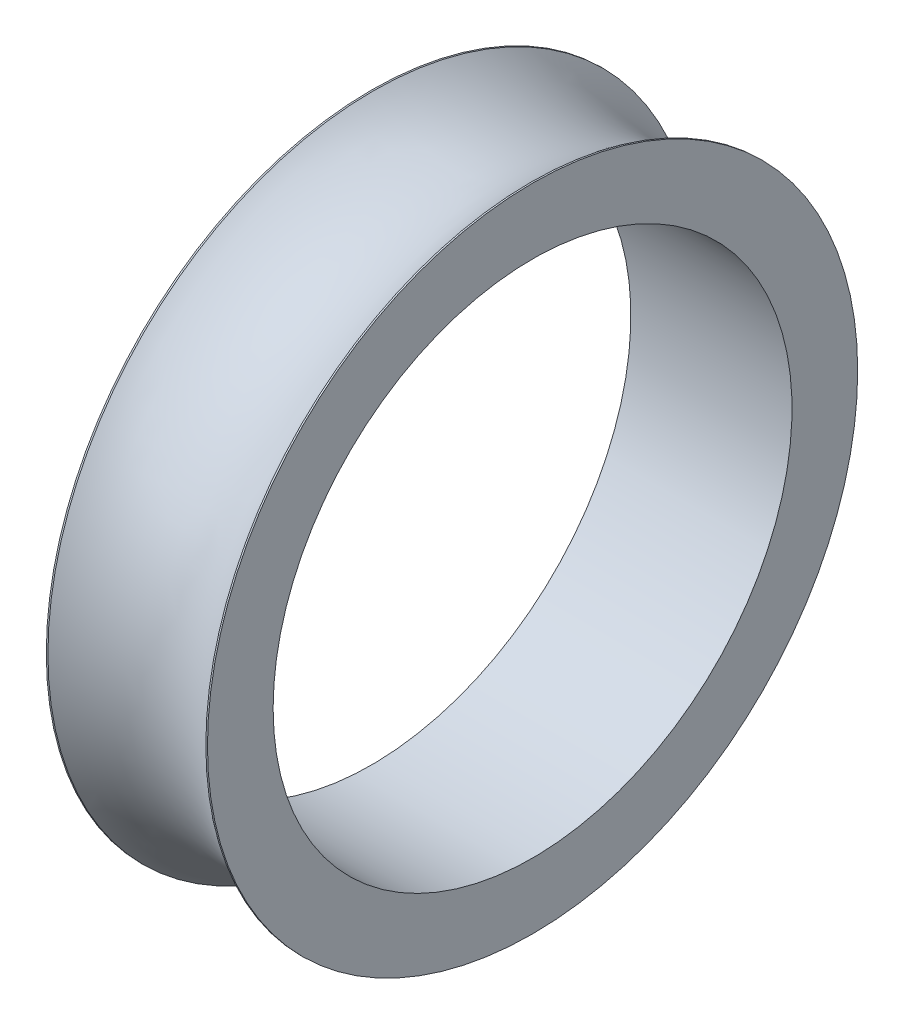
from build123d import *


with BuildPart() as part:
    # Sketch1 → Revolve1 (revolve)
    with BuildSketch(Plane.XY, mode=Mode.PRIVATE) as revolve1_sk:
        with BuildLine():
            Line((-2.45, -3.161882351), (-2.5, -3.161882351))
            Line((-2.5, -3.161882351), (-2.5, -5.2))
            Line((-2.5, -5.2), (2.5, -5.2))
            Line((2.5, -5.2), (2.5, -3.161882351))
            Line((2.5, -3.161882351), (2.45, -3.161882351))
            ThreePointArc((2.45, -3.161882351), (0, -4), (-2.45, -3.161882351))
        make_face()
    revolve(revolve1_sk.sketch.rotate(Axis((-2.5, -13.25, 0), (1, 0, 0)), 90), axis=Axis((-2.5, -13.25, 0), (1, 0, 0)))


solid = part.part
